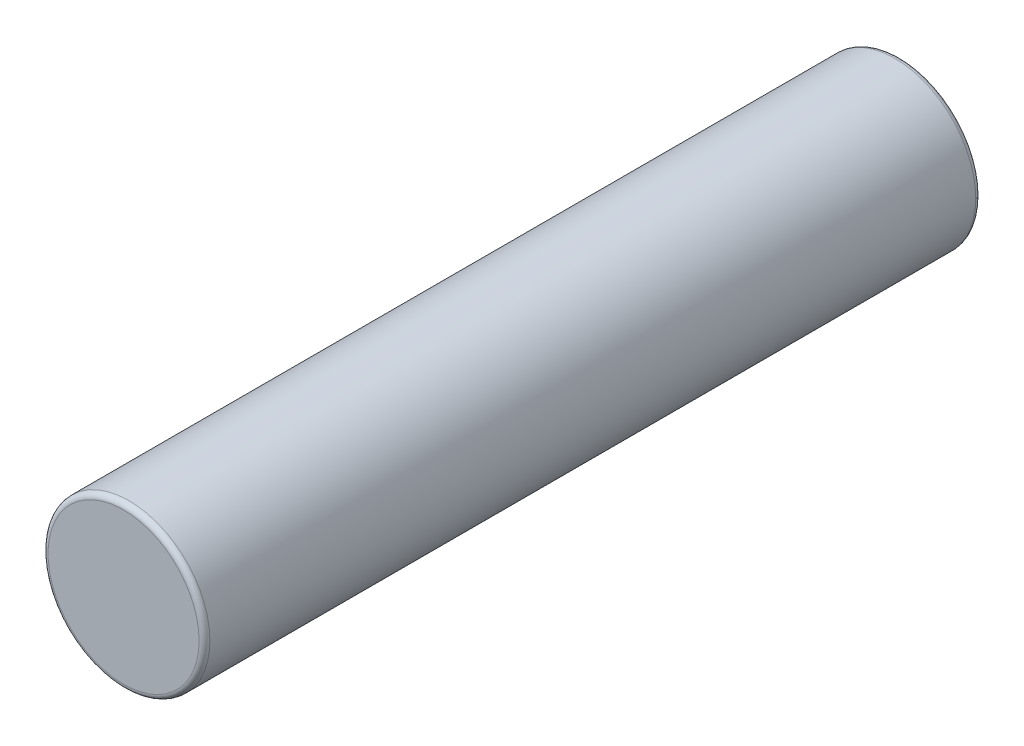
from build123d import *

# Parameters (mm, degrees)
SKETCH_1_R      = 0.75
EXTRUDE_1_DEPTH = 7.2
FILLET_1_R      = 0.05


with BuildPart() as part:
    # 草圖1 → 伸長1 (new body)
    with BuildSketch(Plane.XY):
        Circle(SKETCH_1_R)
    extrude(amount=EXTRUDE_1_DEPTH)

    # 圓角1
    fillet_1_edges = [part.edges().sort_by_distance(p)[0] for p in [
        (-0.75, 0, 0),
        (-0.75, 0, 7.2),
    ]]
    fillet(fillet_1_edges, radius=FILLET_1_R)


solid = part.part
